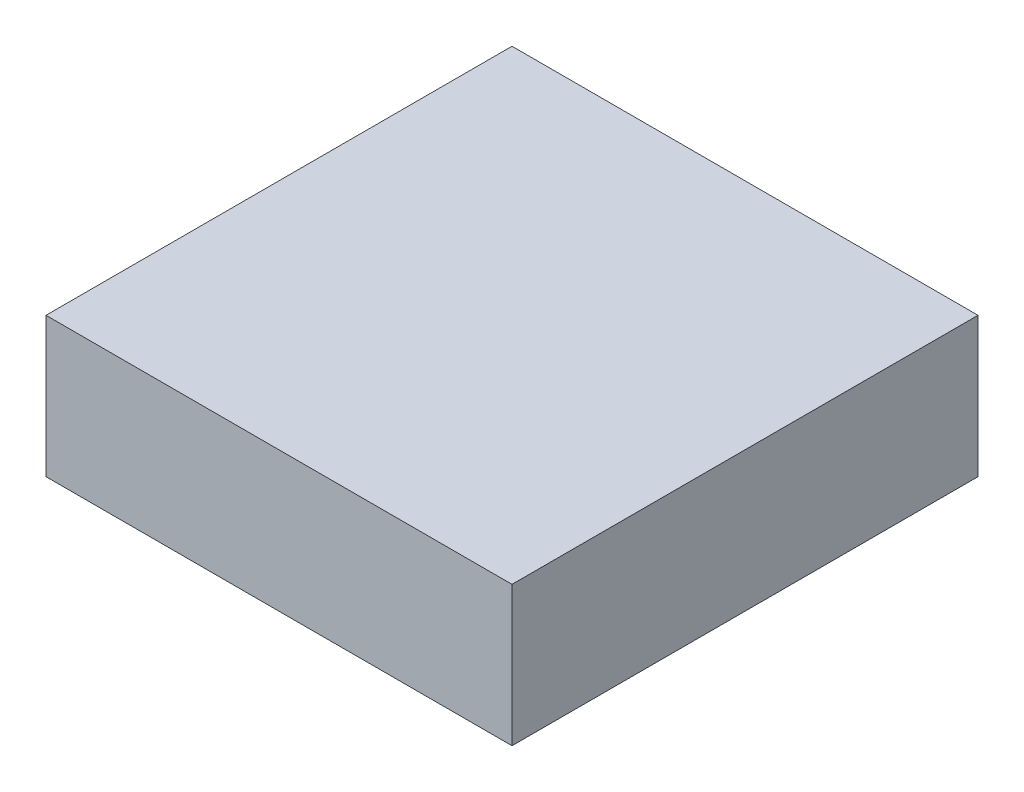
from build123d import *

# Parameters (mm, degrees)
SKETCH1_W           = 500
SKETCH1_H           = 500
BOSS_EXTRUDE1_DEPTH = 150


with BuildPart() as part:
    # Sketch1 → Boss-Extrude1 (new body)
    with BuildSketch(Plane(origin=(0, 0, 0), x_dir=(1, 0, 0), z_dir=(0, 1, 0))):
        with Locations((250, 250)):
            Rectangle(SKETCH1_W, SKETCH1_H)
    extrude(amount=BOSS_EXTRUDE1_DEPTH)


solid = part.part
